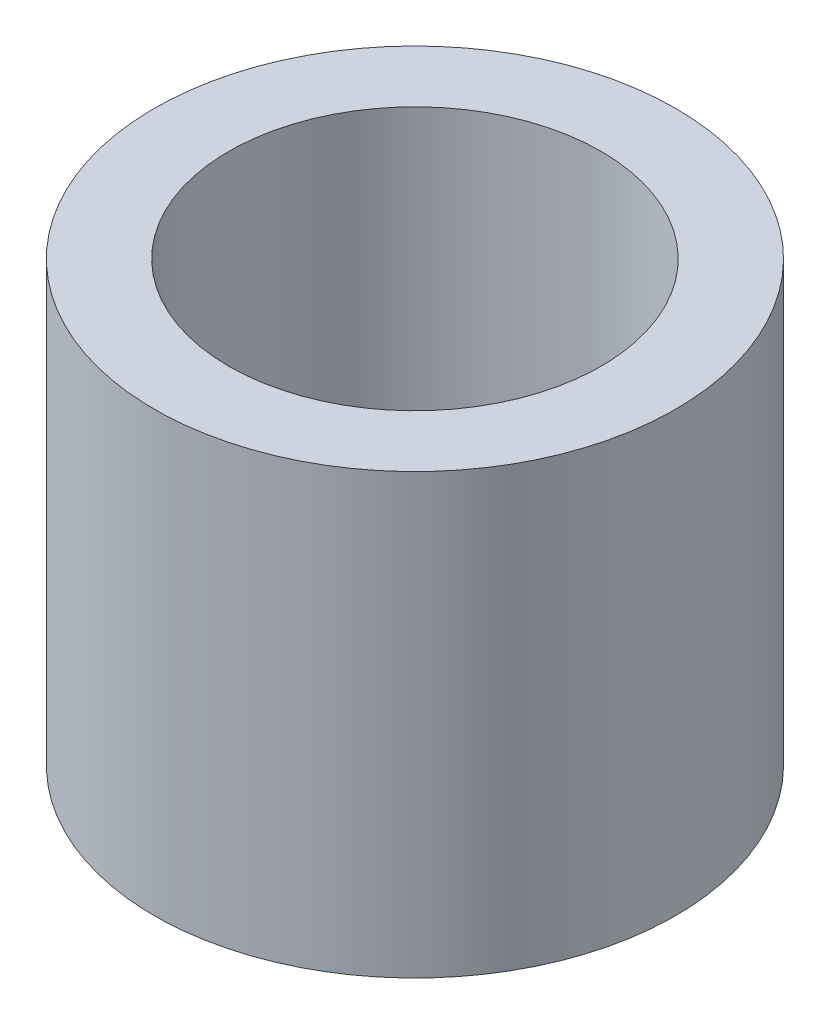
from build123d import *

# Parameters (mm, degrees)
SKETCH1_R           = 3.5
SKETCH1_R_2         = 2.5
BOSS_EXTRUDE1_DEPTH = 5.89026


with BuildPart() as part:
    # Sketch1 → Boss-Extrude1 (new body)
    with BuildSketch(Plane(origin=(0, 0, 0), x_dir=(1, 0, 0), z_dir=(0, 1, 0))):
        with Locations(Location((0, 0, 0), (0, 0, 90))):
            Circle(SKETCH1_R)
        with Locations(Location((0, 0, 0), (0, 0, 90))):
            Circle(SKETCH1_R_2, mode=Mode.SUBTRACT)
    extrude(amount=BOSS_EXTRUDE1_DEPTH)


solid = part.part
